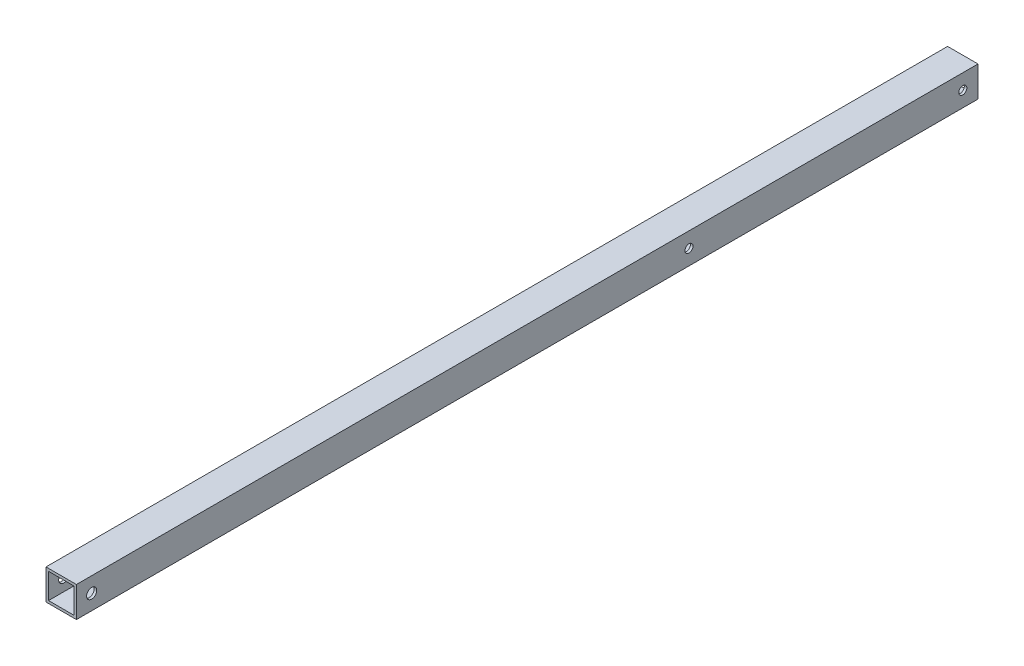
from build123d import *

# Parameters (mm, degrees)
SKETCH2_W                  = 38.1
SKETCH2_H                  = 38.1
SKETCH2_W_2                = 31.75
SKETCH2_H_2                = 31.75
BOSS_EXTRUDE1_DEPTH        = 1129.03
X_0_397_DIAMETER_HOLE1_D   = 10.0838
F_1_2_0_5_DIAMETER_HOLE1_D = 12.7


with BuildPart() as part:
    # Sketch2 → Boss-Extrude1 (new body)
    with BuildSketch(Plane.XY):
        with Locations((19.05, 19.05)):
            Rectangle(SKETCH2_W, SKETCH2_H)
        with Locations((19.05, 19.05)):
            Rectangle(SKETCH2_W_2, SKETCH2_H_2, mode=Mode.SUBTRACT)
    extrude(amount=BOSS_EXTRUDE1_DEPTH)

    # X (0.397) Diameter Hole1 (through all)
    with Locations(Plane.ZY):
        with Locations((19.05, 19.05), (361.95, 19.05)):
            Hole(X_0_397_DIAMETER_HOLE1_D / 2)

    # 1/2 (0.5) Diameter Hole1 (through all)
    with Locations(Plane.ZY):
        with Locations((1109.98, 19.05)):
            Hole(F_1_2_0_5_DIAMETER_HOLE1_D / 2)


solid = part.part
